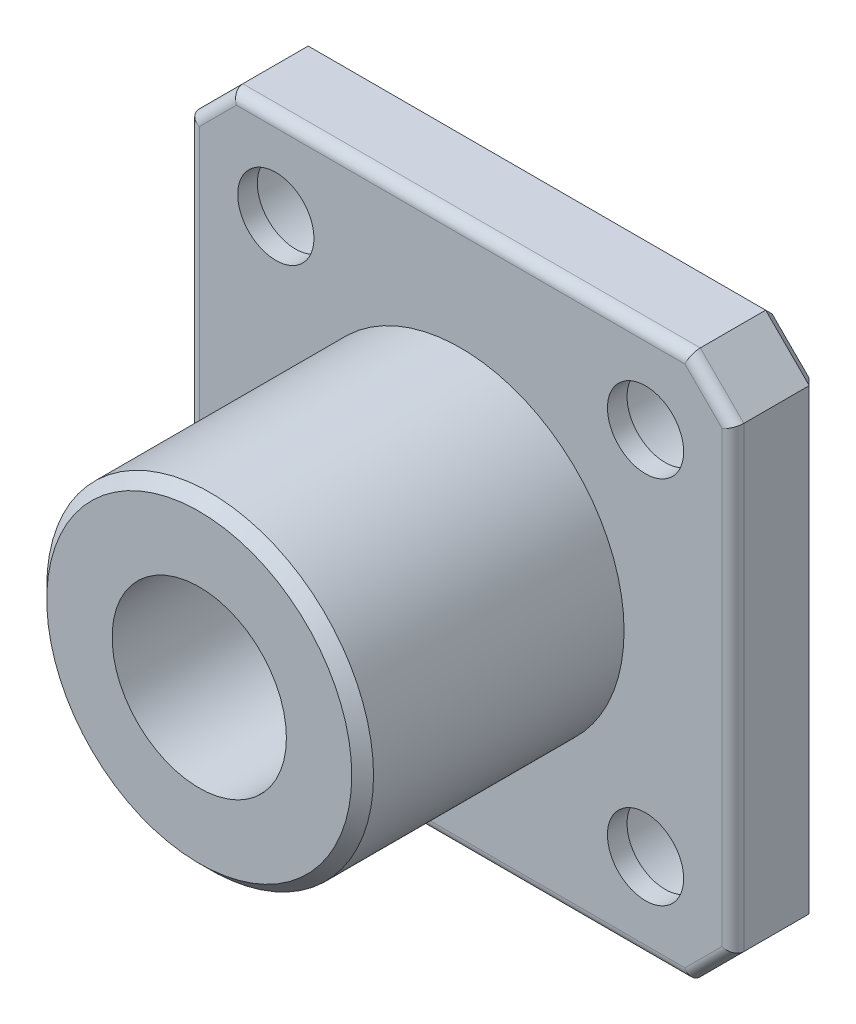
from build123d import *

# Parameters (mm, degrees)
SKETCH_1_R          = 4
SKETCH_1_R_2        = 1.75
EXTRUDE_1_DEPTH     = 4
SKETCH_1_3_R        = 3
SKETCH_1_3_R_2      = 1.75
CUT_EXTRUDE_1_DEPTH = 3.1
SKETCH_2_R          = 7.5
SKETCH_2_R_2        = 4
EXTRUDE_2_DEPTH     = 12
CHAMFER_1_SIZE      = 0.5
CHAMFER_2_SIZE      = 0.5
FILLET_1_R          = 0.5


with BuildPart() as part:
    # 스케치1 → 보스-돌출1 (new body)
    with BuildSketch(Plane.XY):
        Polygon((-10.5, 12.5), (-12.5, 10.5), (-12.5, -10.5), (-10.5, -12.5), (10.5, -12.5), (12.5, -10.5), (12.5, 10.5), (10.5, 12.5), align=None)
        Circle(SKETCH_1_R, mode=Mode.SUBTRACT)
        with Locations((-8.485281374, -8.485281374)):
            Circle(SKETCH_1_R_2, mode=Mode.SUBTRACT)
        with Locations((8.485281374, -8.485281374)):
            Circle(SKETCH_1_R_2, mode=Mode.SUBTRACT)
        with Locations((-8.485281374, 8.485281374)):
            Circle(SKETCH_1_R_2, mode=Mode.SUBTRACT)
        with Locations((8.485281374, 8.485281374)):
            Circle(SKETCH_1_R_2, mode=Mode.SUBTRACT)
    extrude(amount=EXTRUDE_1_DEPTH)

    # 스케치1<3> → 컷-돌출1 (cut)
    # profile 1 of 4: a face of its own
    with BuildSketch(Plane.XY):
        with Locations((-8.485281374, 8.485281374)):
            Circle(SKETCH_1_3_R)
        with Locations((-8.485281374, 8.485281374)):
            Circle(SKETCH_1_3_R_2, mode=Mode.SUBTRACT)
    # profile 2 of 4: a face of its own
    with BuildSketch(Plane.XY):
        with Locations((-8.485281374, -8.485281374)):
            Circle(SKETCH_1_3_R)
        with Locations((-8.485281374, -8.485281374)):
            Circle(SKETCH_1_3_R_2, mode=Mode.SUBTRACT)
    # profile 3 of 4: a face of its own
    with BuildSketch(Plane.XY):
        with Locations((8.485281374, -8.485281374)):
            Circle(SKETCH_1_3_R)
        with Locations((8.485281374, -8.485281374)):
            Circle(SKETCH_1_3_R_2, mode=Mode.SUBTRACT)
    # profile 4 of 4: a face of its own
    with BuildSketch(Plane.XY):
        with Locations((8.485281374, 8.485281374)):
            Circle(SKETCH_1_3_R)
        with Locations((8.485281374, 8.485281374)):
            Circle(SKETCH_1_3_R_2, mode=Mode.SUBTRACT)
    extrude(amount=CUT_EXTRUDE_1_DEPTH, mode=Mode.SUBTRACT)

    # 스케치2 → 보스-돌출2 (add)
    with BuildSketch(Plane.XY.offset(4)):
        Circle(SKETCH_2_R)
        Circle(SKETCH_2_R_2, mode=Mode.SUBTRACT)
    extrude(amount=EXTRUDE_2_DEPTH)

    # 모따기1
    chamfer_1_edges = [part.edges().sort_by_distance(p)[0] for p in [
        (-7.5, 0, 16),
    ]]
    chamfer(chamfer_1_edges, length=CHAMFER_1_SIZE)

    # 모따기2
    chamfer_2_edges = [part.edges().sort_by_distance(p)[0] for p in [
        (-11.5, 11.5, 0),
        (-12.5, 0, 0),
        (-11.5, -11.5, 0),
        (0, -12.5, 0),
        (11.5, -11.5, 0),
        (12.5, 0, 0),
        (11.5, 11.5, 0),
        (0, 12.5, 0),
    ]]
    chamfer(chamfer_2_edges, length=CHAMFER_2_SIZE)

    # 필렛1
    fillet_1_edges = [part.edges().sort_by_distance(p)[0] for p in [
        (-11.5, -11.5, 4),
        (0, -12.5, 4),
        (11.5, -11.5, 4),
        (11.5, 11.5, 4),
        (12.5, 0, 4),
        (-12.5, 0, 4),
        (-11.5, 11.5, 4),
        (0, 12.5, 4),
    ]]
    fillet(fillet_1_edges, radius=FILLET_1_R)


solid = part.part
